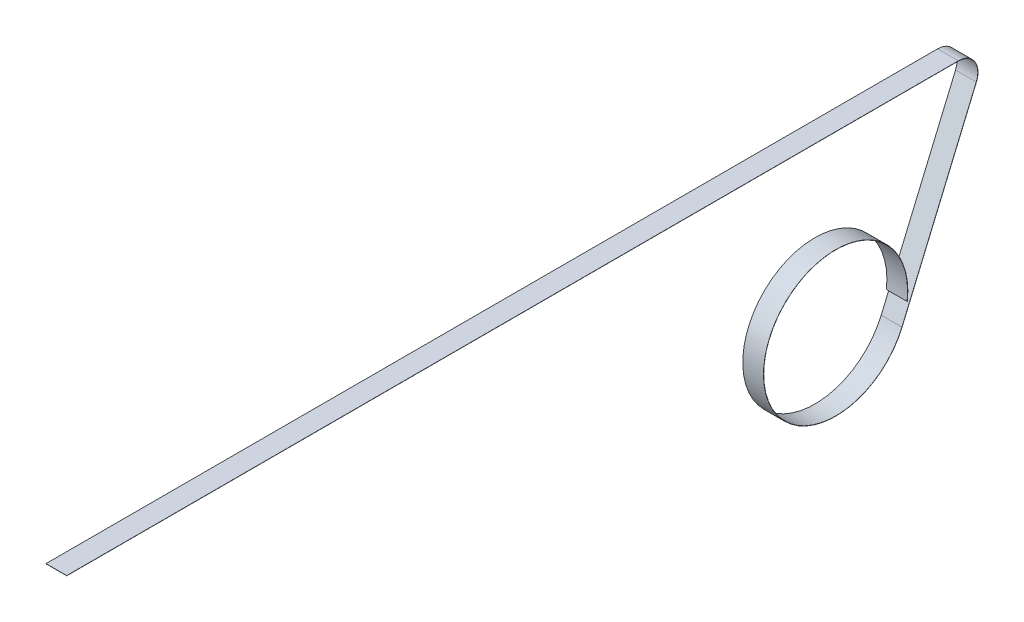
from build123d import *

# Parameters (mm, degrees)
SKETCH1_W           = 25.4
SKETCH1_H           = 0.254
BOSS_EXTRUDE1_DEPTH = 1091.946
BOSS_EXTRUDE4_DEPTH = 25.4


with BuildPart() as part:
    # Sketch1 → Boss-Extrude1 (new body)
    with BuildSketch(Plane.XY):
        with Locations((12.7, 0.127)):
            Rectangle(SKETCH1_W, SKETCH1_H)
    extrude(amount=BOSS_EXTRUDE1_DEPTH)

    # Sketch2 → Boss-Extrude4 (add)
    with BuildSketch(Plane(origin=(25.4, 0, 0), x_dir=(0, 0, -1), z_dir=(1, 0, 0))):
        with BuildLine():
            Line((21.978237679, -33.20447493), (-69.053498166, -247.6786673))
            ThreePointArc((-69.053498166, -247.6786673), (-235.384405248, -190.597617752), (-62.661653687, -223.628935639))
            Line((-62.661653687, -223.628935639), (-62.415163254, -223.707110938))
            ThreePointArc((-62.415163254, -223.707110938), (-235.623641363, -190.508902989), (-68.819687127, -247.777906395))
            Line((-68.819687127, -247.777906395), (22.212048718, -33.303714025))
            ThreePointArc((22.212048718, -33.303714025), (20.121476579, -10.557476047), (0, 0.254))
            Line((0, 0.254), (0, 0))
            ThreePointArc((0, 0), (19.909671562, -10.697671036), (21.978237679, -33.20447493))
        make_face()
    extrude(amount=-BOSS_EXTRUDE4_DEPTH)


solid = part.part
